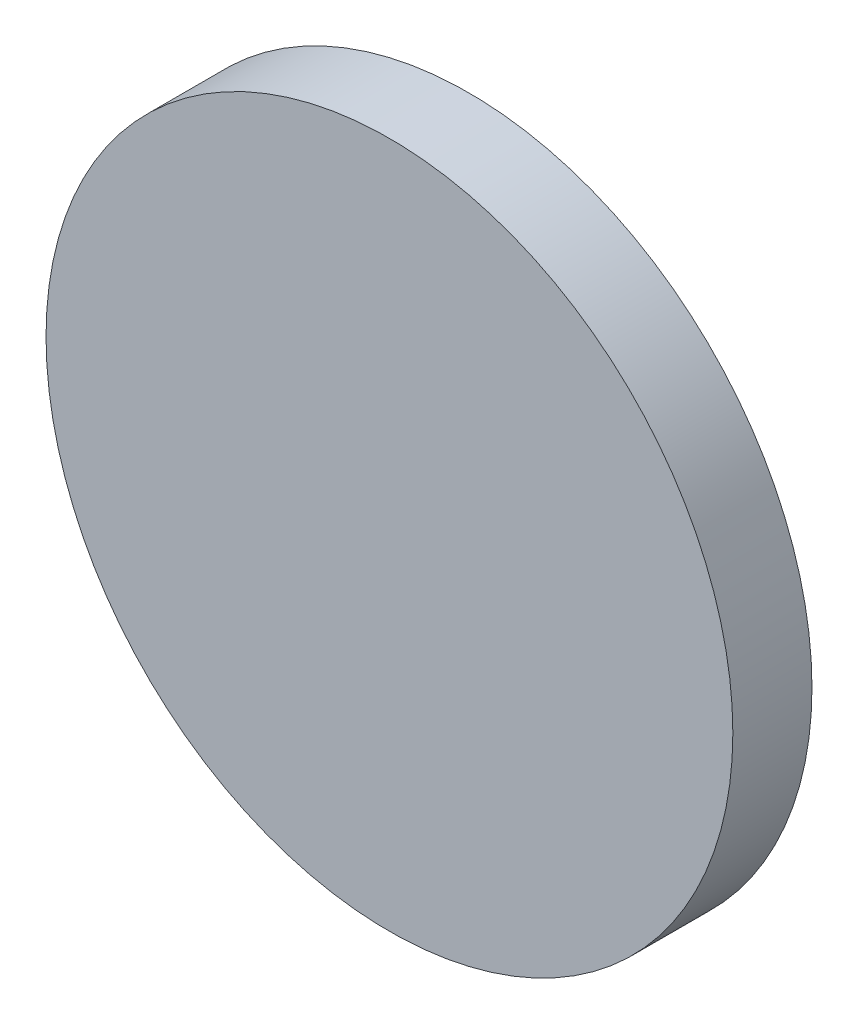
from build123d import *

# Parameters (mm, degrees)
SKETCH1_R      = 22.0472
EXTRUDE1_DEPTH = 5.08


with BuildPart() as part:
    # Sketch1 → Extrude1 (new body)
    with BuildSketch(Plane.XY):
        Circle(SKETCH1_R)
    extrude(amount=EXTRUDE1_DEPTH)


solid = part.part
